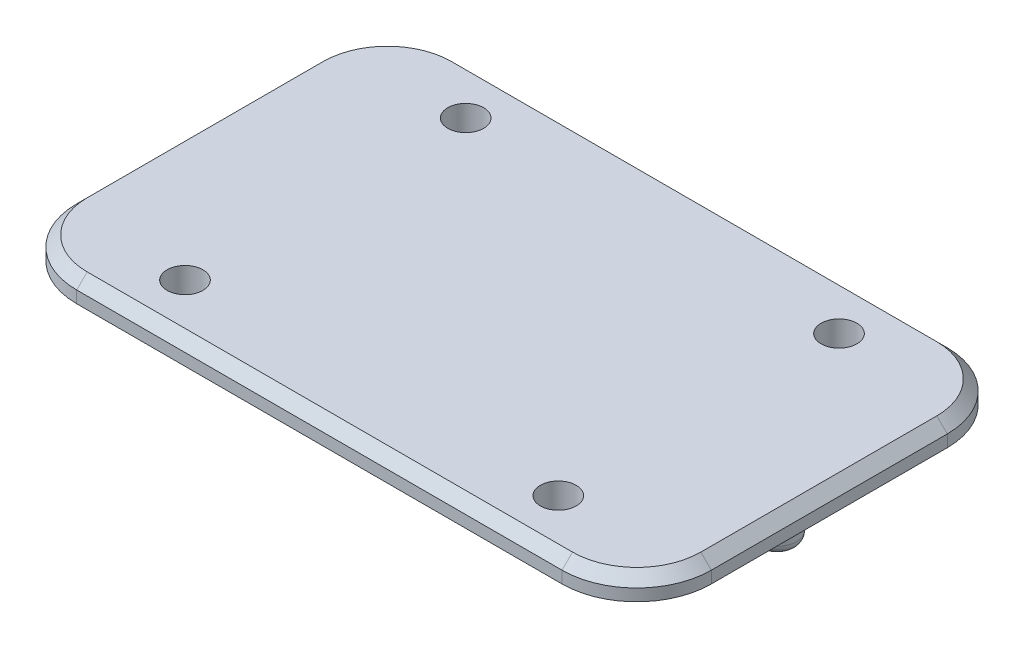
from build123d import *

# Parameters (mm, degrees)
SKETCH2_W           = 42.5
SKETCH2_H           = 25.8
BOSS_EXTRUDE1_DEPTH = 1.5
FILLET1_R           = 5
CHAMFER1_SIZE       = 0.7
BOSS_EXTRUDE2_DEPTH = 1.5
BOSS_EXTRUDE3_DEPTH = 1.7
FILLET2_R           = 0.6
SKETCH5_R           = 1.2
CUT_EXTRUDE1_DEPTH  = 26.039418923


with BuildPart() as part:
    # Sketch2 → Boss-Extrude1 (new body)
    with BuildSketch(Plane(origin=(0, 0, 0), x_dir=(1, 0, 0), z_dir=(0, 1, 0))):
        Rectangle(SKETCH2_W, SKETCH2_H)
    extrude(amount=BOSS_EXTRUDE1_DEPTH)

    # Fillet1
    fillet1_edges = [part.edges().sort_by_distance(p)[0] for p in [
        (21.25, 0.75, -12.9),
        (21.25, 0.75, 12.9),
        (-21.25, 0.75, 12.9),
        (-21.25, 0.75, -12.9),
    ]]
    fillet(fillet1_edges, radius=FILLET1_R)

    # Chamfer1
    chamfer1_edges = [part.edges().sort_by_distance(p)[0] for p in [
        (21.25, 1.5, 0),
        (0, 1.5, 12.9),
        (0, 1.5, -12.9),
        (-21.25, 1.5, 0),
        (-19.785533906, 1.5, 11.435533906),
        (-19.785533906, 1.5, -11.435533906),
        (19.785533906, 1.5, -11.435533906),
        (19.785533906, 1.5, 11.435533906),
    ]]
    chamfer(chamfer1_edges, length=CHAMFER1_SIZE)

    # Sketch3 → Boss-Extrude2 (add)
    with BuildSketch(Plane(origin=(0, 0, 0), x_dir=(1, 0, 0), z_dir=(0, 1, 0))):
        with BuildLine():
            Line((17.75, 1.3), (-17.75, 1.3))
            ThreePointArc((-17.75, 1.3), (-19.05, 0), (-17.75, -1.3))
            Line((-17.75, -1.3), (17.75, -1.3))
            ThreePointArc((17.75, -1.3), (19.05, 0), (17.75, 1.3))
        make_face()
        with BuildLine():
            Line((12.5, 10.7), (-12.5, 10.7))
            ThreePointArc((-12.5, 10.7), (-13.8, 9.4), (-12.5, 8.1))
            Line((-12.5, 8.1), (12.5, 8.1))
            ThreePointArc((12.5, 8.1), (13.8, 9.4), (12.5, 10.7))
        make_face()
        with BuildLine():
            Line((12.5, -8.1), (-12.5, -8.1))
            ThreePointArc((-12.5, -8.1), (-13.8, -9.4), (-12.5, -10.7))
            Line((-12.5, -10.7), (12.5, -10.7))
            ThreePointArc((12.5, -10.7), (13.8, -9.4), (12.5, -8.1))
        make_face()
    extrude(amount=-BOSS_EXTRUDE2_DEPTH)

    # Sketch4 → Boss-Extrude3 (add)
    with BuildSketch(Plane.XZ.offset(1.5)):
        with BuildLine():
            Line((17.75, 1.3), (-17.75, 1.3))
            ThreePointArc((-17.75, 1.3), (-19.05, 0), (-17.75, -1.3))
            Line((-17.75, -1.3), (17.75, -1.3))
            ThreePointArc((17.75, -1.3), (19.05, 0), (17.75, 1.3))
        make_face()
    extrude(amount=BOSS_EXTRUDE3_DEPTH)

    # Fillet2
    fillet2_edges = [part.edges().sort_by_distance(p)[0] for p in [
        (19.05, -3.2, 0),
        (0, -3.2, -1.3),
        (-19.05, -3.2, 0),
        (0, -3.2, 1.3),
    ]]
    fillet(fillet2_edges, radius=FILLET2_R)

    # Sketch5 → Cut-Extrude1 (cut, through all)
    with BuildSketch(Plane.XZ.offset(1.5)):
        with Locations(Location((-12.5, 9.4, 0), (0, 0, 270))):
            Circle(SKETCH5_R)
        with Locations(Location((12.5, 9.4, 0), (0, 0, 270))):
            Circle(SKETCH5_R)
        with Locations(Location((12.5, -9.4, 0), (0, 0, 270))):
            Circle(SKETCH5_R)
        with Locations(Location((-12.5, -9.4, 0), (0, 0, 270))):
            Circle(SKETCH5_R)
    extrude(amount=-CUT_EXTRUDE1_DEPTH, mode=Mode.SUBTRACT)


solid = part.part
